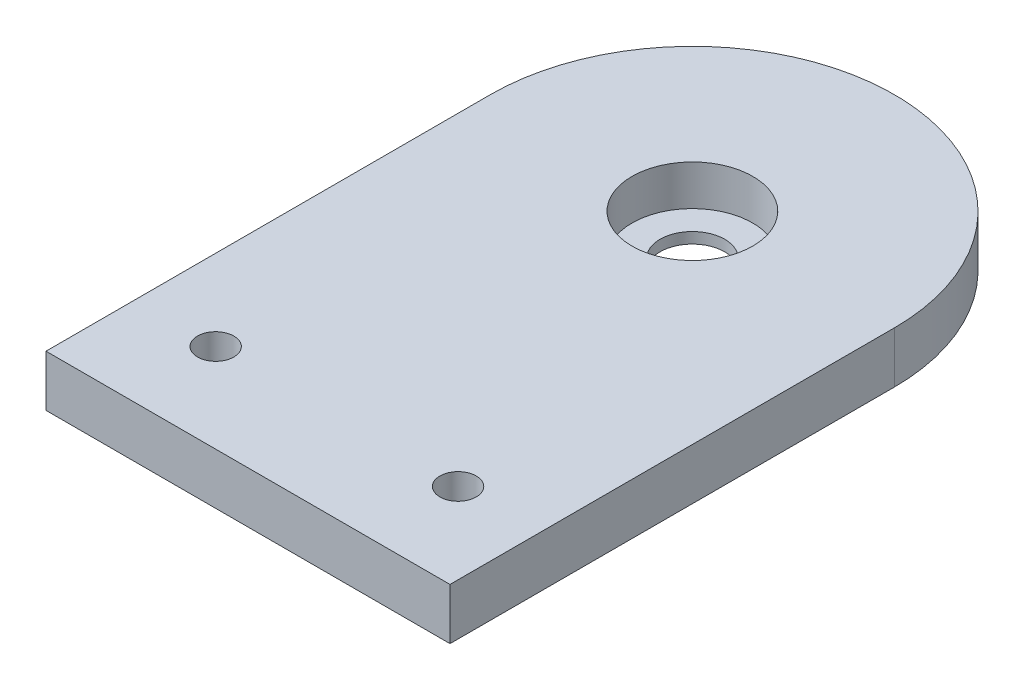
from build123d import *

# Parameters (mm, degrees)
PLACA_START              = -40.85
SK_PLACA_W               = 50
SK_PLACA_H               = 36
PLACA_DEPTH              = 6.35
EXTREMO_START            = -40.85
SK_EXTREMO_R             = 25
EXTREMO_DEPTH            = 6.35
ALOJAMIENTO_696ZZ_START  = -39.5
SK_ALOJAMIENTO_696ZZ_R   = 7.475
ALOJAMIENTO_696ZZ_DEPTH  = 5
PASO_EXTRACTOR_START     = -40.85
SK_PASO_EXTRACTOR_R      = 4
PASO_EXTRACTOR_DEPTH     = 1.35
EXTENSION_PESTANAS_START = -40.85
SK_EXTENSION_PESTANAS_W  = 50
SK_EXTENSION_PESTANAS_H  = 19
EXTENSION_PESTANAS_DEPTH = 6.35
PASANTES_M4_REPISA_START = -40.85
SK_PASANTES_M4_REPISA_R  = 2.25
PASANTES_M4_REPISA_DEPTH = 6.35


with BuildPart() as part:
    # Sk_Placa → Placa (new body)
    with BuildSketch(Plane(origin=(0, 0, 0), x_dir=(1, 0, 0), z_dir=(0, 1, 0)).offset(PLACA_START)):
        with Locations((0, -508)):
            Rectangle(SK_PLACA_W, SK_PLACA_H)
    extrude(amount=PLACA_DEPTH)

    # Sk_Extremo → Extremo (add)
    with BuildSketch(Plane(origin=(0, 0, 0), x_dir=(1, 0, 0), z_dir=(0, 1, 0)).offset(EXTREMO_START)):
        with Locations((0, -490)):
            Circle(SK_EXTREMO_R)
    extrude(amount=EXTREMO_DEPTH)

    # Sk_Alojamiento_696ZZ → Alojamiento_696ZZ (cut)
    with BuildSketch(Plane(origin=(0, 0, 0), x_dir=(1, 0, 0), z_dir=(0, 1, 0)).offset(ALOJAMIENTO_696ZZ_START)):
        with Locations(Location((0, -490, 0), (0, 0, 270))):
            Circle(SK_ALOJAMIENTO_696ZZ_R)
    extrude(amount=ALOJAMIENTO_696ZZ_DEPTH, mode=Mode.SUBTRACT)

    # Sk_Paso_extractor → Paso_extractor (cut)
    with BuildSketch(Plane(origin=(0, 0, 0), x_dir=(1, 0, 0), z_dir=(0, 1, 0)).offset(PASO_EXTRACTOR_START)):
        with Locations(Location((0, -490, 0), (0, 0, 90))):
            Circle(SK_PASO_EXTRACTOR_R)
    extrude(amount=PASO_EXTRACTOR_DEPTH, mode=Mode.SUBTRACT)

    # Sk_Extension_pestanas → Extension_pestanas (add)
    with BuildSketch(Plane(origin=(0, 0, 0), x_dir=(1, 0, 0), z_dir=(0, 1, 0)).offset(EXTENSION_PESTANAS_START)):
        with Locations((0, -535.5)):
            Rectangle(SK_EXTENSION_PESTANAS_W, SK_EXTENSION_PESTANAS_H)
    extrude(amount=EXTENSION_PESTANAS_DEPTH)

    # Sk_Pasantes_M4_repisa → Pasantes_M4_repisa (cut)
    with BuildSketch(Plane(origin=(0, 0, 0), x_dir=(1, 0, 0), z_dir=(0, 1, 0)).offset(PASANTES_M4_REPISA_START)):
        with Locations(Location((-15, -534, 0), (0, 0, 270))):
            Circle(SK_PASANTES_M4_REPISA_R)
        with Locations(Location((15, -534, 0), (0, 0, 270))):
            Circle(SK_PASANTES_M4_REPISA_R)
    extrude(amount=PASANTES_M4_REPISA_DEPTH, mode=Mode.SUBTRACT)


solid = part.part
